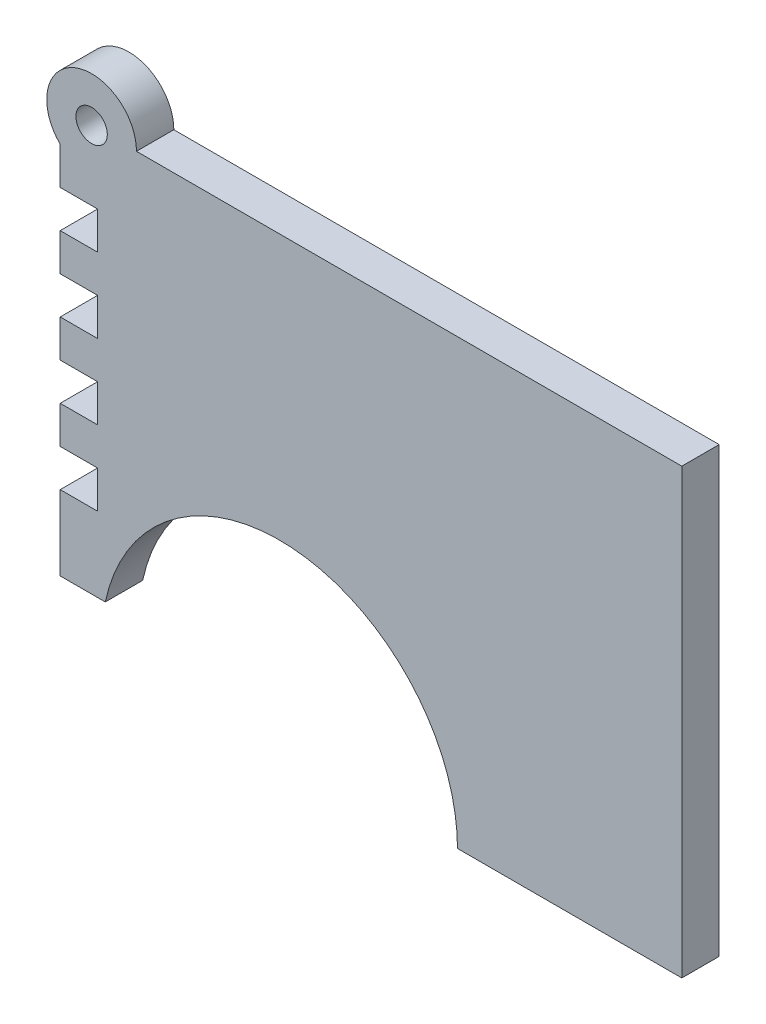
from build123d import *

# Parameters (mm, degrees)
ESQUISSE1_R        = 2.1
BOSS_EXTRU_1_DEPTH = 5


with BuildPart() as part:
    # Esquisse1 → Boss.-Extru.1 (new body)
    with BuildSketch(Plane.XY):
        with BuildLine():
            Line((-78.135883383, 18.842375861), (-83.135883383, 18.842375861))
            Line((-83.135883383, 18.842375861), (-83.135883383, 23.843375961))
            ThreePointArc((-83.135883383, 23.843375961), (-84.935883383, 28.128233018), (-83.135883383, 32.413090075))
            ThreePointArc((-83.135883383, 32.413090075), (-76.612093375, 33.659959692), (-72.935883383, 28.128233018))
            Line((-72.935883383, 28.128233018), (0, 28.128233018))
            Line((0, 28.128233018), (0, 13.842375861))
            Line((0, 13.842375861), (0, -31.157624139))
            Line((0, -31.157624139), (-30, -31.157624139))
            ThreePointArc((-30, -31.157624139), (-51.303897557, -7.472735951), (-77.105155917, -26.157624139))
            Line((-77.105155917, -26.157624139), (-83.135883383, -26.157624139))
            Line((-83.135883383, -26.157624139), (-83.135883383, -16.157624139))
            Line((-83.135883383, -16.157624139), (-78.135883383, -16.157624139))
            Line((-78.135883383, -16.157624139), (-78.135883383, -11.157624139))
            Line((-78.135883383, -11.157624139), (-83.135883383, -11.157624139))
            Line((-83.135883383, -11.157624139), (-83.135883383, -6.157624139))
            Line((-83.135883383, -6.157624139), (-78.135883383, -6.157624139))
            Line((-78.135883383, -6.157624139), (-78.135883383, -1.157624139))
            Line((-78.135883383, -1.157624139), (-83.135883383, -1.157624139))
            Line((-83.135883383, -1.157624139), (-83.135883383, 3.842375861))
            Line((-83.135883383, 3.842375861), (-78.135883383, 3.842375861))
            Line((-78.135883383, 3.842375861), (-78.135883383, 8.842375861))
            Line((-78.135883383, 8.842375861), (-83.135883383, 8.842375861))
            Line((-83.135883383, 8.842375861), (-83.135883383, 13.842375861))
            Line((-83.135883383, 13.842375861), (-78.135883383, 13.842375861))
            Line((-78.135883383, 13.842375861), (-78.135883383, 18.842375861))
        make_face()
        with Locations((-78.935883383, 28.128233018)):
            Circle(ESQUISSE1_R, mode=Mode.SUBTRACT)
    extrude(amount=BOSS_EXTRU_1_DEPTH)


solid = part.part
